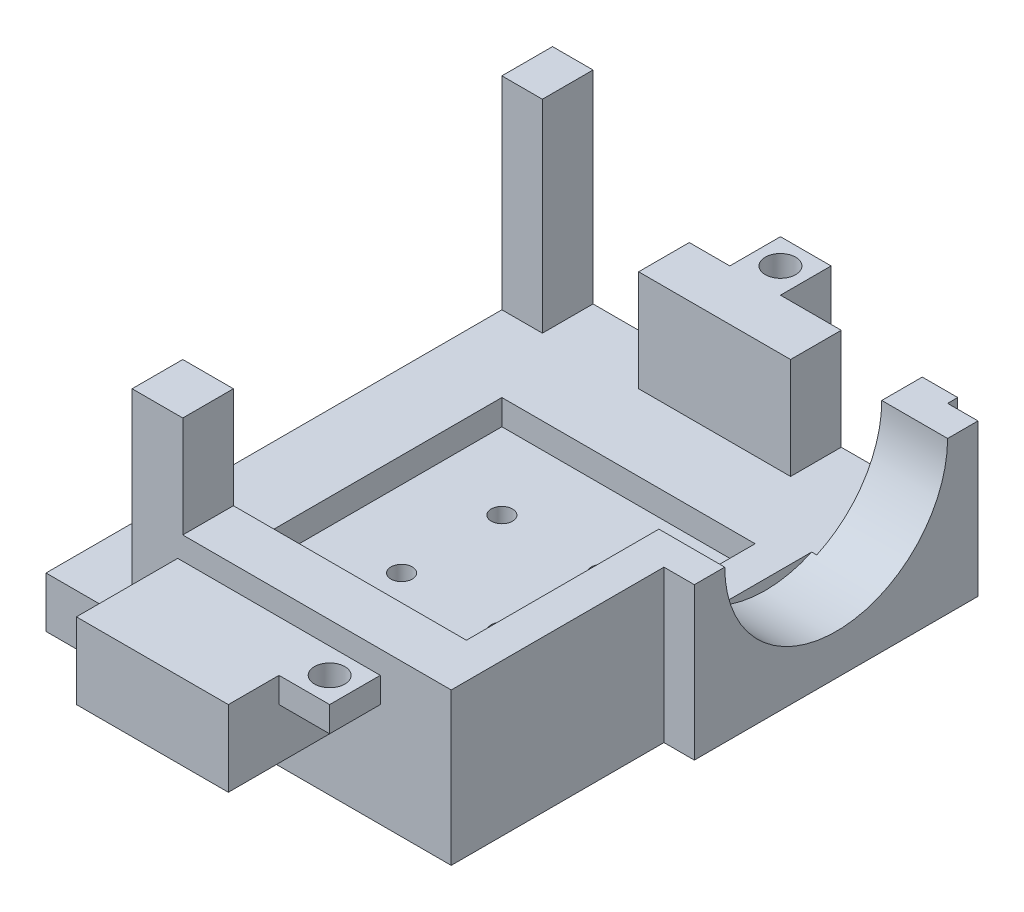
from build123d import *

# Parameters (mm, degrees)
SKETCH1_W            = 40
SKETCH1_H            = 50
BOSS_EXTRUDE1_DEPTH  = 5
SKETCH4_W            = 5
SKETCH4_H            = 5
SKETCH4_W_2          = 4
BOSS_EXTRUDE4_DEPTH  = 20
SKETCH4_4_W          = 15
SKETCH4_4_H          = 5
BOSS_EXTRUDE5_DEPTH  = 10
CUT_EXTRUDE2_DEPTH   = 4
BOSS_EXTRUDE7_START  = 3
BOSS_EXTRUDE7_DEPTH  = 3
SKETCH11_W           = 5
SKETCH11_H           = 5
BOSS_EXTRUDE8_DEPTH  = 5
SKETCH12_R           = 1.5
CUT_EXTRUDE6_DEPTH   = 5
SKETCH15_W           = 5
SKETCH15_H           = 2.5
BOSS_EXTRUDE11_DEPTH = 5
BOSS_EXTRUDE12_DEPTH = 10
SKETCH16_R           = 1.5
CUT_EXTRUDE8_DEPTH   = 2.5
SKETCH18_R           = 1.05
CUT_EXTRUDE9_DEPTH   = 5
SKETCH19_W           = 25
SKETCH19_H           = 25
CUT_EXTRUDE10_DEPTH  = 2.5


with BuildPart() as part:
    # Sketch1 → Boss-Extrude1 (new body)
    with BuildSketch(Plane(origin=(0, 0, 0), x_dir=(1, 0, 0), z_dir=(0, 1, 0))):
        Rectangle(SKETCH1_W, SKETCH1_H)
    extrude(amount=BOSS_EXTRUDE1_DEPTH)

    # Sketch4 → Boss-Extrude4 (add)
    with BuildSketch(Plane(origin=(0, 5, 0), x_dir=(1, 0, 0), z_dir=(0, 1, 0))):
        with Locations((-9, -22.5)):
            Rectangle(SKETCH4_W, SKETCH4_H)
        with Locations((-18, 22.5)):
            Rectangle(SKETCH4_W_2, SKETCH4_H)
    extrude(amount=BOSS_EXTRUDE4_DEPTH)

    # Sketch4<4> → Boss-Extrude5 (add)
    with BuildSketch(Plane(origin=(0, 5, 0), x_dir=(1, 0, 0), z_dir=(0, 1, 0))):
        Polygon((20, -25), (20, 25), (16.5, 25), (16.5, -20), (-6.5, -20), (-6.5, -25), align=None)
        with Locations((1, 22.5)):
            Rectangle(SKETCH4_4_W, SKETCH4_4_H)
    extrude(amount=BOSS_EXTRUDE5_DEPTH)

    # Sketch7 → Cut-Extrude2 (cut)
    with BuildSketch(Plane(origin=(20, 0, 0), x_dir=(0, 0, -1), z_dir=(1, 0, 0))):
        with BuildLine():
            Line((-1, 15), (21, 15))
            ThreePointArc((21, 15), (10, 4), (-1, 15))
        make_face()
    extrude(amount=-CUT_EXTRUDE2_DEPTH, mode=Mode.SUBTRACT)

    # Sketch8 → Boss-Extrude7 (add)
    with BuildSketch(Plane(origin=(20, 0, 0), x_dir=(0, 0, -1), z_dir=(1, 0, 0)).offset(BOSS_EXTRUDE7_START)):
        with BuildLine():
            Line((-1, 15), (-4, 15))
            Line((-4, 15), (-4, 0))
            Line((-4, 0), (24, 0))
            Line((24, 0), (24, 15))
            Line((24, 15), (21, 15))
            ThreePointArc((21, 15), (10, 4), (-1, 15))
        make_face()
    extrude(amount=-BOSS_EXTRUDE7_DEPTH)

    # Sketch11 → Boss-Extrude8 (add)
    with BuildSketch(Plane(origin=(0, 0, -25), x_dir=(-1, 0, 0), z_dir=(0, 0, -1))):
        with Locations((0, 12.5)):
            Rectangle(SKETCH11_W, SKETCH11_H)
    extrude(amount=BOSS_EXTRUDE8_DEPTH)

    # Sketch12 → Cut-Extrude6 (cut)
    with BuildSketch(Plane.XZ.offset(-10)):
        with Locations((0, -27.5)):
            Circle(SKETCH12_R)
    extrude(amount=-CUT_EXTRUDE6_DEPTH, mode=Mode.SUBTRACT)

    # Sketch15 → Boss-Extrude11 (add)
    with BuildSketch(Plane.XY.offset(25)):
        with Locations((10.5, 11.5)):
            Rectangle(SKETCH15_W, SKETCH15_H)
    extrude(amount=BOSS_EXTRUDE11_DEPTH)

    # Sketch15<3> → Boss-Extrude12 (add)
    with BuildSketch(Plane.XY.offset(25)):
        Polygon((8, 10.25), (8, 12.75), (-7, 12.75), (-7, 5.25), (8, 5.25), align=None)
    extrude(amount=BOSS_EXTRUDE12_DEPTH)

    # Sketch16 → Cut-Extrude8 (cut)
    with BuildSketch(Plane.XZ.offset(-10.25)):
        with Locations((10.5, 27.5)):
            Circle(SKETCH16_R)
    extrude(amount=-CUT_EXTRUDE8_DEPTH, mode=Mode.SUBTRACT)

    # Sketch18 → Cut-Extrude9 (cut)
    with BuildSketch(Plane.XZ):
        with Locations((-4.949747468, 4.949747468)):
            Circle(SKETCH18_R)
        with Locations((4.949747468, 4.949747468)):
            Circle(SKETCH18_R)
        with Locations((4.949747468, -4.949747468)):
            Circle(SKETCH18_R)
        with Locations((-4.949747468, -4.949747468)):
            Circle(SKETCH18_R)
    extrude(amount=-CUT_EXTRUDE9_DEPTH, mode=Mode.SUBTRACT)

    # Sketch19 → Cut-Extrude10 (cut)
    with BuildSketch(Plane(origin=(0, 5, 0), x_dir=(1, 0, 0), z_dir=(0, 1, 0))):
        Rectangle(SKETCH19_W, SKETCH19_H)
    extrude(amount=-CUT_EXTRUDE10_DEPTH, mode=Mode.SUBTRACT)


solid = part.part
